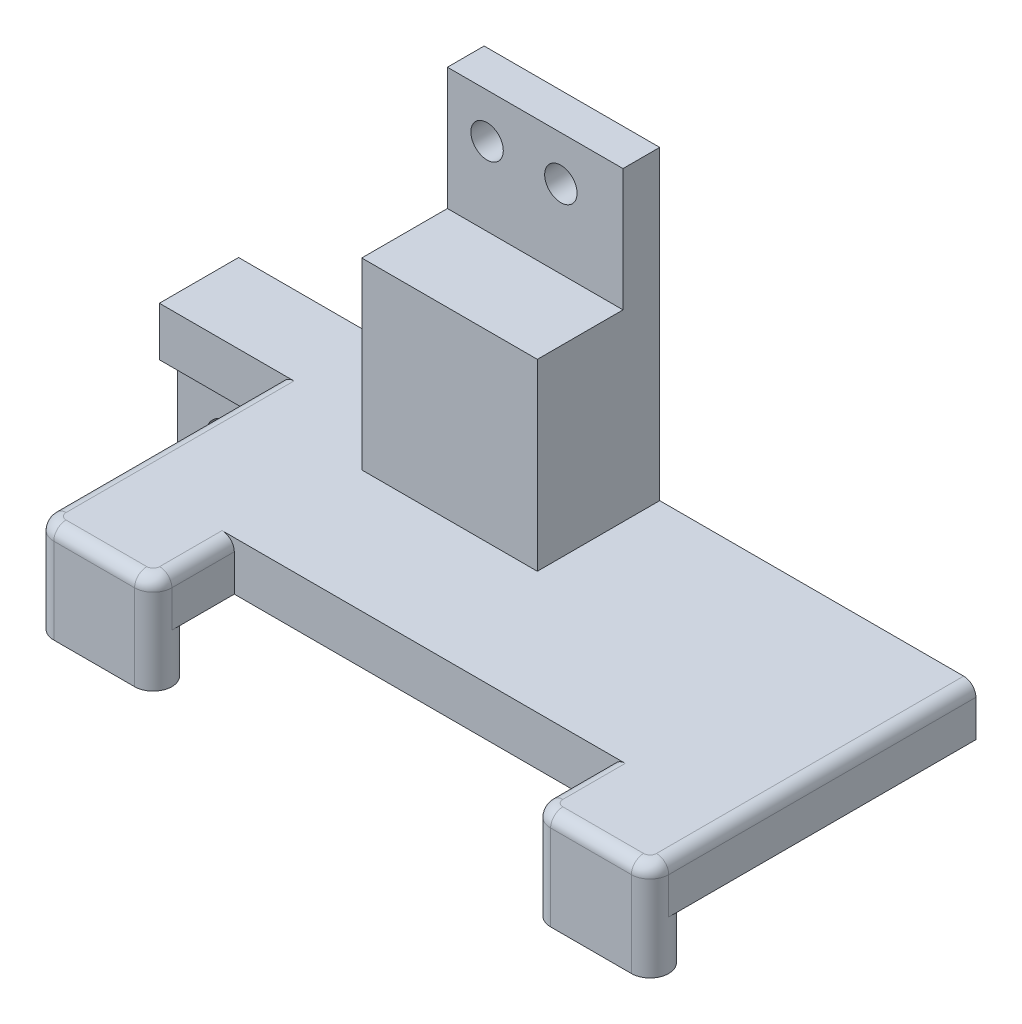
from build123d import *

# Parameters (mm, degrees)
BOSS_EXTRUDE1_DEPTH   = 4
BOSS_EXTRUDE1_2_DEPTH = 4
SKETCH3_W             = 10
SKETCH3_H             = 6.473357475
SKETCH3_W_2           = 50.25
BOSS_EXTRUDE3_DEPTH   = 4
FILLET2_R             = 1
SKETCH4_W             = 14.347682942
SKETCH4_H             = 10
BOSS_EXTRUDE4_DEPTH   = 15
SKETCH6_W             = 14.347682942
SKETCH6_H             = 3
BOSS_EXTRUDE6_DEPTH   = 10
CUT_EXTRUDE1_REACH    = 55.674
SKETCH7_R             = 1.325
SKETCH8_W             = 16.45797352
SKETCH8_H             = 4
SKETCH8_H_2           = 11.134864375
SKETCH8_R             = 1.8
BOSS_EXTRUDE7_DEPTH   = 5


with BuildPart() as part:
    # Sketch1 → Boss-Extrude1 (new body)
    with BuildSketch(Plane(origin=(0, 0, 0), x_dir=(1, 0, 0), z_dir=(0, 1, 0))):
        with BuildLine():
            Line((-23.6, 10.542278437), (-17, 10.542278437))
            ThreePointArc((-17, 10.542278437), (-15.475, 9.017278437), (-17, 7.492278437))
            Line((-17, 7.492278437), (-23.6, 7.492278437))
            ThreePointArc((-23.6, 7.492278437), (-25.125, 9.017278437), (-23.6, 10.542278437))
        make_face()
    extrude(amount=BOSS_EXTRUDE1_DEPTH)



with BuildPart() as body_2:
    # Sketch1 → Boss-Extrude1 2 (new body)
    with BuildSketch(Plane(origin=(0, 0, 0), x_dir=(1, 0, 0), z_dir=(0, 1, 0))):
        with BuildLine():
            Line((23.6, 7.492278437), (17, 7.492278437))
            ThreePointArc((17, 7.492278437), (15.475, 9.017278437), (17, 10.542278437))
            Line((17, 10.542278437), (23.6, 10.542278437))
            ThreePointArc((23.6, 10.542278437), (25.125, 9.017278437), (23.6, 7.492278437))
        make_face()
    extrude(amount=BOSS_EXTRUDE1_2_DEPTH)


with BuildPart() as part_1:
    add(part.part)

    add(body_2.part)  # Boss-Extrude3 merges body 2
    # Sketch3 → Boss-Extrude3 (add)
    with BuildSketch(Plane(origin=(0, 4, 0), x_dir=(1, 0, 0), z_dir=(0, 1, 0))):
        with Locations((-30.125, 30.8805997)):
            Rectangle(SKETCH3_W, SKETCH3_H)
        with Locations((0, 30.8805997)):
            Rectangle(SKETCH3_W_2, SKETCH3_H)
        with BuildLine():
            Line((25.125, 27.643920962), (-25.125, 27.643920962))
            Line((-25.125, 27.643920962), (-25.125, 18.723444743))
            Line((-25.125, 18.723444743), (-25.125, 9.017278437))
            ThreePointArc((-25.125, 9.017278437), (-24.678337841, 7.938940596), (-23.6, 7.492278437))
            Line((-23.6, 7.492278437), (-17, 7.492278437))
            ThreePointArc((-17, 7.492278437), (-15.921662159, 7.938940596), (-15.475, 9.017278437))
            Line((-15.475, 9.017278437), (-15.475, 14.117278437))
            Line((-15.475, 14.117278437), (15.475, 14.117278437))
            Line((15.475, 14.117278437), (15.475, 9.017278437))
            ThreePointArc((15.475, 9.017278437), (15.921662159, 7.938940596), (17, 7.492278437))
            Line((17, 7.492278437), (23.6, 7.492278437))
            ThreePointArc((23.6, 7.492278437), (24.678337841, 7.938940596), (25.125, 9.017278437))
            Line((25.125, 9.017278437), (25.125, 18.723444743))
            Line((25.125, 18.723444743), (25.125, 27.643920962))
        make_face()
    extrude(amount=BOSS_EXTRUDE3_DEPTH)

    # Fillet2
    fillet2_edges = [part_1.edges().sort_by_distance(p)[0] for p in [
        (-25.125, 8, -18.3305997),
        (15.475, 8, -11.567278437),
        (-24.678337841, 8, -7.938940596),
        (-20.3, 8, -7.492278437),
        (-15.921662159, 8, -7.938940596),
        (-15.475, 8, -11.567278437),
        (15.921662159, 8, -7.938940596),
        (20.3, 8, -7.492278437),
        (24.678337841, 8, -7.938940596),
        (25.125, 8, -21.567278437),
    ]]
    fillet(fillet2_edges, radius=FILLET2_R)

    # Sketch4 → Boss-Extrude4 (add)
    with BuildSketch(Plane(origin=(0, 8, 0), x_dir=(1, 0, 0), z_dir=(0, 1, 0))):
        with Locations((-7.885296824, 29.117278437)):
            Rectangle(SKETCH4_W, SKETCH4_H)
    extrude(amount=BOSS_EXTRUDE4_DEPTH)

    # Sketch6 → Boss-Extrude6 (add)
    with BuildSketch(Plane(origin=(0, 23, 0), x_dir=(1, 0, 0), z_dir=(0, 1, 0))):
        with Locations((-7.885296824, 32.617278437)):
            Rectangle(SKETCH6_W, SKETCH6_H)
    extrude(amount=BOSS_EXTRUDE6_DEPTH)

    # Sketch7 → Cut-Extrude1 (cut, up to next)
    with BuildSketch(Plane.XY.offset(-31.117278437), mode=Mode.PRIVATE) as cut_extrude1_sk1:
        with Locations((-11.819138295, 29.375)):
            Circle(SKETCH7_R)
    cut_extrude1_tool1 = extrude(cut_extrude1_sk1.sketch, amount=-CUT_EXTRUDE1_REACH, mode=Mode.PRIVATE) & part_1.part
    # Sketch7 → Cut-Extrude1 (cut, up to next)
    with BuildSketch(Plane.XY.offset(-31.117278437), mode=Mode.PRIVATE) as cut_extrude1_sk2:
        with Locations((-5.789138295, 29.375)):
            Circle(SKETCH7_R)
    cut_extrude1_tool2 = extrude(cut_extrude1_sk2.sketch, amount=-CUT_EXTRUDE1_REACH, mode=Mode.PRIVATE) & part_1.part
    add(cut_extrude1_tool1.solids().sort_by_distance((-11.819138, 29.375, -31.117278))[0], mode=Mode.SUBTRACT)
    add(cut_extrude1_tool2.solids().sort_by_distance((-5.789138, 29.375, -31.117278))[0], mode=Mode.SUBTRACT)

    # Sketch8 → Boss-Extrude7 (add)
    # profile 1 of 2: a face of its own
    with BuildSketch(Plane(origin=(0, 0, -34.117278437), x_dir=(-1, 0, 0), z_dir=(0, 0, -1))):
        with Locations((26.89601324, 6)):
            Rectangle(SKETCH8_W, SKETCH8_H)
    # profile 2 of 2: a face of its own
    with BuildSketch(Plane(origin=(0, 0, -34.117278437), x_dir=(-1, 0, 0), z_dir=(0, 0, -1))):
        with Locations((26.89601324, -1.567432188)):
            Rectangle(SKETCH8_W, SKETCH8_H_2)
        with Locations((22.984760942, -0.83124894)):
            Circle(SKETCH8_R, mode=Mode.SUBTRACT)
        with Locations((30.984760942, -0.83124894)):
            Circle(SKETCH8_R, mode=Mode.SUBTRACT)
    extrude(amount=-BOSS_EXTRUDE7_DEPTH)


solid = part_1.part
